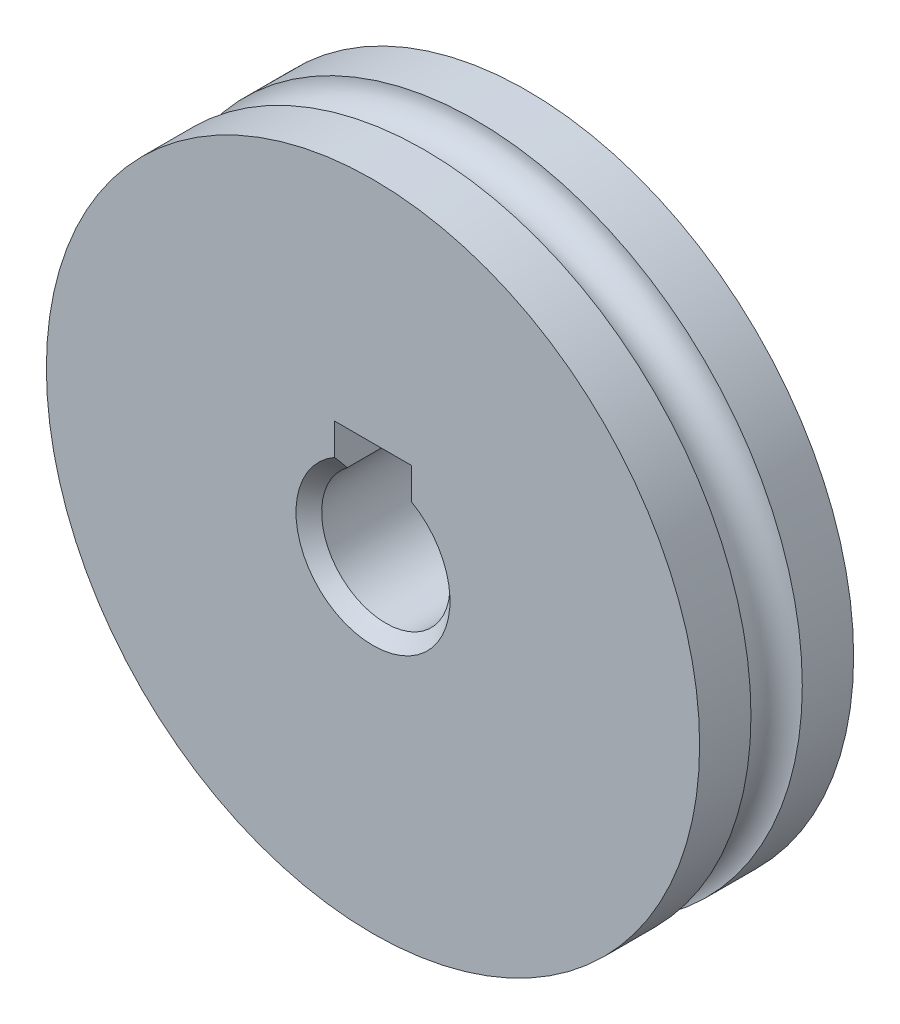
from build123d import *

# Parameters (mm, degrees)
SKETCH_3_R          = 25.45
SKETCH_3_R_2        = 5
EXTRUDE_1_DEPTH     = 12
CHAMFER_1_SIZE      = 1
CUT_EXTRUDE_1_DEPTH = 19
SKETCH_6_R          = 2


with BuildPart() as part:
    # 草图3 → 凸台-拉伸1 (new body)
    with BuildSketch(Plane.XY):
        Circle(SKETCH_3_R)
        Circle(SKETCH_3_R_2, mode=Mode.SUBTRACT)
    extrude(amount=EXTRUDE_1_DEPTH)

    # 倒角1
    chamfer_1_edges = [part.edges().sort_by_distance(p)[0] for p in [
        (-5, 0, 0),
        (-5, 0, 12),
    ]]
    chamfer(chamfer_1_edges, length=CHAMFER_1_SIZE)

    # 草图8 → 切除-拉伸1 (cut)
    with BuildSketch(Plane(origin=(0, 0, 0), x_dir=(-1, 0, 0), z_dir=(0, 0, -1))):
        Polygon((0, 7.65), (-3, 7.65), (-3, 0), (0, 0), (3, 0), (3, 7.65), align=None)
    extrude(amount=-CUT_EXTRUDE_1_DEPTH, mode=Mode.SUBTRACT)

    # 草图6 → 切除-旋转1 (revolve, cut)
    with BuildSketch(Plane(origin=(0, 0, 0), x_dir=(1, 0, 0), z_dir=(0, 1, 0))):
        with Locations((25.45, -6)):
            Circle(SKETCH_6_R)
    revolve(axis=Axis((0, 0, 0), (0, 0, -1)), mode=Mode.SUBTRACT)


solid = part.part
